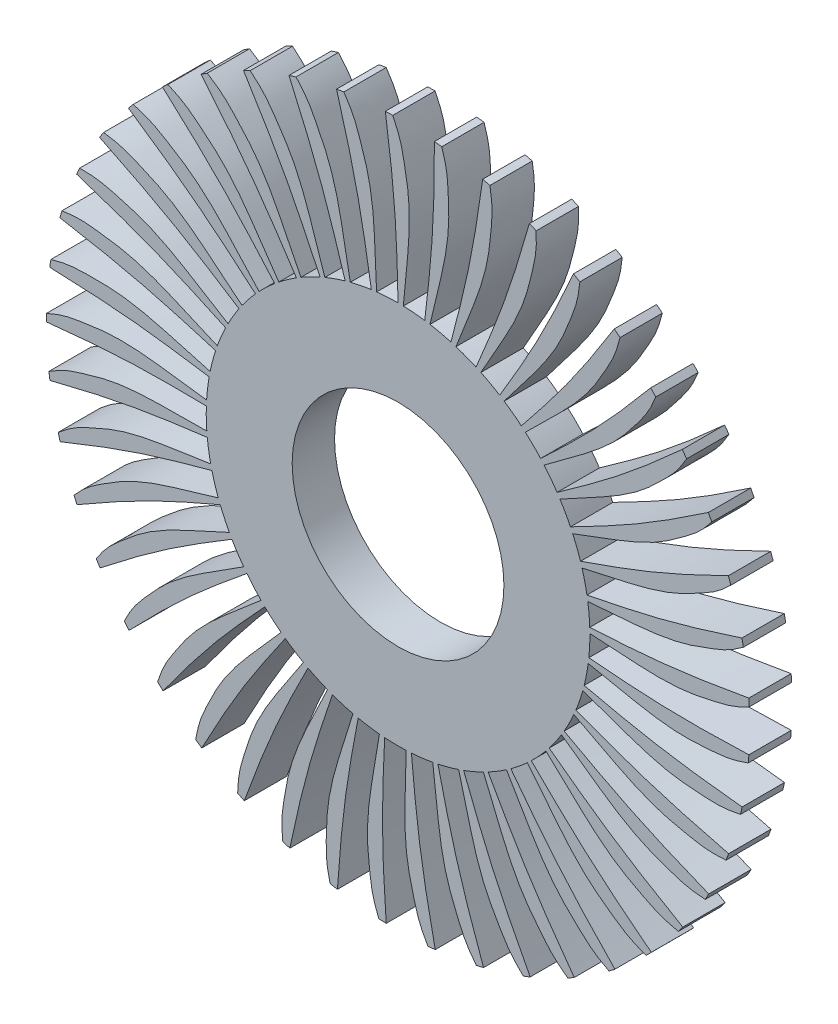
from build123d import *

# Parameters (mm, degrees)
BOSS_EXTRUDE1_DEPTH = 40
SKETCH2_R           = 100
CUT_EXTRUDE1_DEPTH  = 472.364222761


with BuildPart() as part:
    # Sketch1 → Boss-Extrude1 (new body)
    with BuildSketch(Plane.XY):
        with BuildLine():
            ThreePointArc((49.939154436, 174.158528494), (40.110835246, 176.681162236), (30.156704053, 178.649616271))
            add(Edge.make_bspline(
                [(30.156704053, 178.649616271), (39.310370514, 218.953952007), (49.29964751, 249.304595735), (47.011651755, 302.781305637), (46.663179355, 313.349789228), (41.265784538, 329.547796542)],
                knots=[0, 0, 0, 0, 0.60181753, 0.70181753, 1, 1, 1, 1], degree=3))
            ThreePointArc((41.265784538, 329.547796542), (37.789474803, 329.964499262), (34.308965449, 330.344532373))
            add(Edge.make_bspline(
                [(25.214967549, 179.413816649), (31.339924784, 231.63978581), (34.519677665, 260.968132794), (34.308965449, 330.344532373)],
                knots=[0, 0, 0, 0, 1, 1, 1, 1], degree=3))
            ThreePointArc((25.214967549, 179.413816649), (15.131214125, 180.544062634), (5, 181.108012504))
            add(Edge.make_bspline(
                [(5, 181.108012504), (8.455304222, 222.294053362), (14.123373057, 253.739565367), (4.415124374, 306.37741614), (2.59919465, 316.794549991), (-5, 332.083747237)],
                knots=[0, 0, 0, 0, 0.60181753, 0.70181753, 1, 1, 1, 1], degree=3))
            ThreePointArc((-5, 332.083747237), (-8.500472337, 332.012585829), (-12, 331.904527205))
            add(Edge.make_bspline(
                [(0, 181.177018943), (-1.203100506, 233.747157854), (-2.136009757, 263.23261945), (-12, 331.904527205)],
                knots=[0, 0, 0, 0, 1, 1, 1, 1], degree=3))
            ThreePointArc((0, 181.177018943), (-10.142918867, 180.892878218), (-20.254023365, 180.041347281))
            add(Edge.make_bspline(
                [(-20.254023365, 180.041347281), (-22.564334949, 221.307453824), (-21.327796787, 253.235782983), (-38.267338382, 304.010238737), (-41.515380424, 314.073265186), (-51.168465225, 328.156065532)],
                knots=[0, 0, 0, 0, 0.60181753, 0.70181753, 1, 1, 1, 1], degree=3))
            ThreePointArc((-51.168465225, 328.156065532), (-54.624967452, 327.598425072), (-58.075399099, 327.00437795))
            add(Edge.make_bspline(
                [(-25.214967549, 179.413816649), (-33.722708814, 231.304907354), (-38.75012218, 260.373582591), (-58.075399099, 327.00437795)],
                knots=[0, 0, 0, 0, 1, 1, 1, 1], degree=3))
            ThreePointArc((-25.214967549, 179.413816649), (-35.219631481, 177.72081969), (-45.113825204, 175.470382027))
            add(Edge.make_bspline(
                [(-45.113825204, 175.470382027), (-53.144785007, 216.01335643), (-56.363845327, 247.803054136), (-80.204970924, 295.725847844), (-84.82190584, 305.238901528), (-96.340994478, 317.841199284)],
                knots=[0, 0, 0, 0, 0.60181753, 0.70181753, 1, 1, 1, 1], degree=3))
            ThreePointArc((-96.340994478, 317.841199284), (-99.686249711, 316.807933609), (-103.020426614, 315.739460441))
            add(Edge.make_bspline(
                [(-49.939154436, 174.158528494), (-65.585942954, 224.360569937), (-74.610007552, 252.446670117), (-103.020426614, 315.739460441)],
                knots=[0, 0, 0, 0, 1, 1, 1, 1], degree=3))
            ThreePointArc((-49.939154436, 174.158528494), (-59.61083403, 171.089627562), (-69.095537752, 167.484085381))
            add(Edge.make_bspline(
                [(-69.095537752, 167.484085381), (-82.690832275, 206.514804765), (-90.30283573, 237.547120711), (-120.581504939, 281.685489705), (-126.477469342, 290.463409856), (-139.638355859, 301.33991563)],
                knots=[0, 0, 0, 0, 0.60181753, 0.70181753, 1, 1, 1, 1], degree=3))
            ThreePointArc((-139.638355859, 301.33991563), (-142.807252511, 299.851136082), (-145.960278709, 298.329033482))
            add(Edge.make_bspline(
                [(-73.691332487, 165.513442685), (-96.172621317, 213.049309233), (-109.017693995, 239.606170364), (-145.960278709, 298.329033482)],
                knots=[0, 0, 0, 0, 1, 1, 1, 1], degree=3))
            ThreePointArc((-73.691332487, 165.513442685), (-82.841779501, 161.128370445), (-91.732384252, 156.237901524))
            add(Edge.make_bspline(
                [(-91.732384252, 156.237901524), (-110.627396553, 192.996677333), (-122.484184154, 222.667602788), (-158.611057119, 262.162443922), (-165.67129277, 270.034378309), (-180.21781548, 278.973393288)],
                knots=[0, 0, 0, 0, 0.60181753, 0.70181753, 1, 1, 1, 1], degree=3))
            ThreePointArc((-180.21781548, 278.973393288), (-183.148674581, 277.058077266), (-186.059180006, 275.111971231))
            add(Edge.make_bspline(
                [(-96.009192574, 153.646825982), (-124.887409, 197.591286065), (-141.303475029, 222.102009052), (-186.059180006, 275.111971231)],
                knots=[0, 0, 0, 0, 1, 1, 1, 1], degree=3))
            ThreePointArc((-96.009192574, 153.646825982), (-104.460303965, 148.030932878), (-112.583764237, 141.950724631))
            add(Edge.make_bspline(
                [(-112.583764237, 141.950724631), (-136.410724394, 175.722089106), (-152.281517256, 203.454113257), (-193.55342549, 237.536704374), (-201.640512932, 244.349434747), (-217.289540318, 251.176971173)],
                knots=[0, 0, 0, 0, 0.60181753, 0.70181753, 1, 1, 1, 1], degree=3))
            ThreePointArc((-217.289540318, 251.176971173), (-219.925316029, 248.872398125), (-222.536651003, 246.540167395))
            add(Edge.make_bspline(
                [(-116.458342937, 138.789648582), (-151.171405325, 178.28737327), (-170.838944653, 200.274884771), (-222.536651003, 246.540167395)],
                knots=[0, 0, 0, 0, 1, 1, 1, 1], degree=3))
            ThreePointArc((-116.458342937, 138.789648582), (-124.045627434, 132.052241585), (-131.243829313, 124.900638351))
            add(Edge.make_bspline(
                [(-131.243829313, 124.900638351), (-159.538972649, 155.027270296), (-179.114863844, 180.280620837), (-224.728496598, 208.287583068), (-233.685029873, 213.908507381), (-250.131971416, 218.491675023)],
                knots=[0, 0, 0, 0, 0.60181753, 0.70181753, 1, 1, 1, 1], degree=3))
            ThreePointArc((-250.131971416, 218.491675023), (-252.421361362, 215.842700843), (-254.682699221, 213.169739636))
            add(Edge.make_bspline(
                [(-134.640764123, 121.231088544), (-174.513022201, 155.513299554), (-197.049228545, 174.549637668), (-254.682699221, 213.169739636)],
                knots=[0, 0, 0, 0, 1, 1, 1, 1], degree=3))
            ThreePointArc((-134.640764123, 121.231088544), (-141.216543865, 113.503303616), (-147.349382539, 105.419503217))
            add(Edge.make_bspline(
                [(-147.349382539, 105.419503217), (-179.561976275, 131.315022011), (-202.461943346, 153.598171198), (-251.529483145, 174.984380882), (-261.18113352, 179.304094236), (-278.105868212, 181.55368695)],
                knots=[0, 0, 0, 0, 0.60181753, 0.70181753, 1, 1, 1, 1], degree=3))
            ThreePointArc((-278.105868212, 181.55368695), (-280.004312021, 178.611870907), (-281.871638395, 175.650205372))
            add(Edge.make_bspline(
                [(-150.202555987, 101.312903265), (-194.457941604, 129.712336355), (-219.424173344, 145.426980414), (-281.871638395, 175.650205372)],
                knots=[0, 0, 0, 0, 1, 1, 1, 1], degree=3))
            ThreePointArc((-150.202555987, 101.312903265), (-155.638840901, 92.745152951), (-160.586947642, 83.886497366))
            add(Edge.make_bspline(
                [(-160.586947642, 83.886497366), (-196.090010281, 105.046876191), (-221.868331419, 123.926107873), (-273.434734412, 138.275306764), (-283.593643492, 141.209730852), (-300.666750623, 141.081962875)],
                knots=[0, 0, 0, 0, 0.60181753, 0.70181753, 1, 1, 1, 1], degree=3))
            ThreePointArc((-300.666750623, 141.081962875), (-302.137297246, 137.904564071), (-303.574266753, 134.71183966))
            add(Edge.make_bspline(
                [(-162.840825952, 79.422777566), (-210.617958367, 101.386670075), (-237.5282762, 113.473752408), (-303.574266753, 134.71183966)],
                knots=[0, 0, 0, 0, 1, 1, 1, 1], degree=3))
            ThreePointArc((-162.840825952, 79.422777566), (-167.031804936, 70.18182338), (-170.698870473, 60.720736263))
            add(Edge.make_bspline(
                [(-170.698870473, 60.720736263), (-208.801375286, 76.734112415), (-236.956304791, 91.841963822), (-290.017889602, 98.874861086), (-300.486325777, 100.366880681), (-317.375496737, 97.86423887)],
                knots=[0, 0, 0, 0, 0.60181753, 0.70181753, 1, 1, 1, 1], degree=3))
            ThreePointArc((-317.375496737, 97.86423887), (-318.389523657, 94.51310176), (-319.368167318, 91.151461221))
            add(Edge.make_bspline(
                [(-172.309584469, 55.986777844), (-222.678536145, 71.087627587), (-251.009161345, 79.311886885), (-319.368167318, 91.151461221)],
                knots=[0, 0, 0, 0, 1, 1, 1, 1], degree=3))
            ThreePointArc((-172.309584469, 55.986777844), (-175.173684883, 46.252484448), (-177.488333958, 36.373115097))
            add(Edge.make_bspline(
                [(-177.488333958, 36.373115097), (-217.44865903, 46.927806424), (-247.432193225, 57.970220413), (-300.956176461, 57.549928705), (-311.530383528, 57.570503343), (-327.906889817, 52.741698775)],
                knots=[0, 0, 0, 0, 0.60181753, 0.70181753, 1, 1, 1, 1], degree=3))
            ThreePointArc((-327.906889817, 52.741698775), (-328.444660153, 49.28204943), (-328.945929783, 45.816923272))
            add(Edge.make_bspline(
                [(-178.424532923, 31.461059175), (-230.40492951, 39.40494529), (-259.604438682, 43.6063057), (-328.945929783, 45.816923272)],
                knots=[0, 0, 0, 0, 1, 1, 1, 1], degree=3))
            ThreePointArc((-178.424532923, 31.461059175), (-179.906008311, 21.422893517), (-180.823188913, 11.31753262))
            add(Edge.make_bspline(
                [(-180.823188913, 11.31753262), (-221.863551969, 16.208104061), (-253.092095468, 22.970152605), (-306.036693677, 15.104852423), (-316.510856725, 13.653581643), (-332.055948274, 6.592601507)],
                knots=[0, 0, 0, 0, 0.60181753, 0.70181753, 1, 1, 1, 1], degree=3))
            ThreePointArc((-332.055948274, 6.592601507), (-332.106994939, 3.091778065), (-332.121133895, -0.409388971))
            add(Edge.make_bspline(
                [(-181.066650798, 6.322986775), (-233.646753003, 6.955290555), (-263.146810916, 7.051977377), (-332.121133895, -0.409388971)],
                knots=[0, 0, 0, 0, 1, 1, 1, 1], degree=3))
            ThreePointArc((-181.066650798, 6.322986775), (-181.136665928, -3.823669668), (-180.638526178, -13.958332756))
            add(Edge.make_bspline(
                [(-180.638526178, -13.958332756), (-221.960123235, -14.827070611), (-253.82584796, -12.477003096), (-305.160554763, -27.634222629), (-315.330806121, -30.529091493), (-329.741915407, -39.684813252)],
                knots=[0, 0, 0, 0, 0.60181753, 0.70181753, 1, 1, 1, 1], degree=3))
            ThreePointArc((-329.741915407, -39.684813252), (-329.305244835, -43.158671243), (-328.831977918, -46.627732925))
            add(Edge.make_bspline(
                [(-180.184512277, -18.93815537), (-232.340908219, -25.629741), (-261.567329801, -29.639609665), (-328.831977918, -46.627732925)],
                knots=[0, 0, 0, 0, 1, 1, 1, 1], degree=3))
            ThreePointArc((-180.184512277, -18.93815537), (-178.841704382, -28.995809473), (-176.937940005, -38.962515062))
            add(Edge.make_bspline(
                [(-176.937940005, -38.962515062), (-217.736493179, -45.573653219), (-249.619169045, -47.681308124), (-298.344812766, -69.835428971), (-308.01320006, -74.117550589), (-321.009831232, -85.189808261)],
                knots=[0, 0, 0, 0, 0.60181753, 0.70181753, 1, 1, 1, 1], degree=3))
            ThreePointArc((-321.009831232, -85.189808261), (-320.093942719, -88.569086107), (-319.142481531, -91.938521095))
            add(Edge.make_bspline(
                [(-175.79528718, -43.830687862), (-226.51281194, -57.715918799), (-254.896738139, -65.75429542), (-319.142481531, -91.938521095)],
                knots=[0, 0, 0, 0, 1, 1, 1, 1], degree=3))
            ThreePointArc((-175.79528718, -43.830687862), (-173.065792489, -53.603578828), (-169.793458093, -63.208336332))
            add(Edge.make_bspline(
                [(-169.793458093, -63.208336332), (-209.274869954, -75.433196507), (-240.553936941, -81.957550726), (-285.72212835, -110.677368125), (-294.700467419, -116.263395871), (-306.029655835, -129.036680554)],
                knots=[0, 0, 0, 0, 0.60181753, 0.70181753, 1, 1, 1, 1], degree=3))
            ThreePointArc((-306.029655835, -129.036680554), (-304.652376109, -132.255604456), (-303.241239761, -135.45983053))
            add(Edge.make_bspline(
                [(-167.984406783, -67.870105872), (-216.275901431, -88.678721889), (-243.264871411, -100.589148608), (-303.241239761, -135.45983053)],
                knots=[0, 0, 0, 0, 1, 1, 1, 1], degree=3))
            ThreePointArc((-167.984406783, -67.870105872), (-163.921351806, -77.168015494), (-159.344139657, -86.223879233))
            add(Edge.make_bspline(
                [(-159.344139657, -86.223879233), (-196.739949433, -103.824518428), (-226.806596081, -114.638582829), (-267.53818771, -149.365098202), (-275.651725397, -156.146306399), (-285.092961291, -170.372000637)],
                knots=[0, 0, 0, 0, 0.60181753, 0.70181753, 1, 1, 1, 1], degree=3))
            ThreePointArc((-285.092961291, -170.372000637), (-283.281097536, -173.367917903), (-281.43775219, -176.344568448))
            add(Edge.make_bspline(
                [(-156.903900987, -90.588509472), (-201.829426511, -117.915494529), (-226.89813067, -133.466148438), (-281.43775219, -176.344568448)],
                knots=[0, 0, 0, 0, 1, 1, 1, 1], degree=3))
            ThreePointArc((-156.903900987, -90.588509472), (-151.586368467, -99.230464517), (-145.793368794, -107.561172403))
            add(Edge.make_bspline(
                [(-145.793368794, -107.561172403), (-180.375709584, -130.195014197), (-208.644722817, -145.088305316), (-244.146920566, -185.145606542), (-251.237736089, -192.990006688), (-258.607256544, -208.391223524)],
                knots=[0, 0, 0, 0, 0.60181753, 0.70181753, 1, 1, 1, 1], degree=3))
            ThreePointArc((-258.607256544, -208.391223524), (-256.396074626, -211.105822031), (-254.156398904, -213.796959929))
            add(Edge.make_bspline(
                [(-142.769439234, -111.543710778), (-183.454571381, -144.857176194), (-206.115075908, -163.745381503), (-254.156398904, -213.796959929)],
                knots=[0, 0, 0, 0, 1, 1, 1, 1], degree=3))
            ThreePointArc((-142.769439234, -111.543710778), (-136.300928893, -119.36150542), (-129.404895845, -126.804909702))
            add(Edge.make_bspline(
                [(-129.404895845, -126.804909702), (-160.500661722, -154.031412109), (-186.421817354, -172.714048976), (-216.003611326, -217.322466252), (-221.933690027, -226.077376019), (-227.08805571, -242.354348285)],
                knots=[0, 0, 0, 0, 0.60181753, 0.70181753, 1, 1, 1, 1], degree=3))
            ThreePointArc((-227.08805571, -242.354348285), (-224.52059377, -244.734791462), (-221.928180412, -247.088036776))
            add(Edge.make_bspline(
                [(-125.856132744, -130.327840633), (-161.508981696, -168.979377698), (-181.320225647, -190.837496975), (-221.928180412, -247.088036776)],
                knots=[0, 0, 0, 0, 1, 1, 1, 1], degree=3))
            ThreePointArc((-125.856132744, -130.327840633), (-118.362546778, -137.169310392), (-110.497703794, -143.580533672))
            add(Edge.make_bspline(
                [(-110.497703794, -143.580533672), (-137.501651047, -174.869763793), (-160.570423267, -196.978110131), (-183.656037493, -245.269391356), (-188.309957134, -254.764406385), (-191.14884418, -271.600321332)],
                knots=[0, 0, 0, 0, 0.60181753, 0.70181753, 1, 1, 1, 1], degree=3))
            ThreePointArc((-191.14884418, -271.600321332), (-188.275074945, -273.60027656), (-185.380382328, -275.569826046))
            add(Edge.make_bspline(
                [(-106.493179789, -146.575287315), (-136.419803396, -189.812587825), (-152.996183441, -214.215177643), (-185.380382328, -275.569826046)],
                knots=[0, 0, 0, 0, 1, 1, 1, 1], degree=3))
            ThreePointArc((-106.493179789, -146.575287315), (-98.120372325, -152.307270765), (-89.439799628, -157.561525874))
            add(Edge.make_bspline(
                [(-89.439799628, -157.561525874), (-111.826327139, -192.304474436), (-131.593708537, -217.408216433), (-147.733807795, -268.442426747), (-151.020985125, -278.492737371), (-151.489137827, -295.559903064)],
                knots=[0, 0, 0, 0, 0.60181753, 0.70181753, 1, 1, 1, 1], degree=3))
            ThreePointArc((-151.489137827, -295.559903064), (-148.364995946, -297.140443489), (-145.224365968, -298.687962108))
            add(Edge.make_bspline(
                [(-85.057458224, -159.969812757), (-108.675368798, -206.95131184), (-121.694244556, -233.423403544), (-145.224365968, -298.687962108)],
                knots=[0, 0, 0, 0, 1, 1, 1, 1], degree=3))
            ThreePointArc((-85.057458224, -159.969812757), (-75.968396435, -164.48074336), (-66.641051498, -168.475762199))
            add(Edge.make_bspline(
                [(-66.641051498, -168.475762199), (-83.974430975, -205.996197227), (-100.055671957, -233.606719099), (-108.936107574, -286.390535651), (-110.792561425, -296.800524005), (-108.880867722, -313.766747478)],
                knots=[0, 0, 0, 0, 0.60181753, 0.70181753, 1, 1, 1, 1], degree=3))
            ThreePointArc((-108.880867722, -313.766747478), (-105.567161063, -314.897109679), (-102.241722516, -315.99247674))
            add(Edge.make_bspline(
                [(-61.966189986, -170.250707757), (-78.815691763, -220.061963973), (-88.023665625, -248.088308411), (-102.241722516, -315.99247674)],
                knots=[0, 0, 0, 0, 1, 1, 1, 1], degree=3))
            ThreePointArc((-61.966189986, -170.250707757), (-52.337782122, -173.452785379), (-42.545211104, -176.11080945))
            add(Edge.make_bspline(
                [(-42.545211104, -176.11080945), (-54.488068031, -215.678438356), (-66.570165533, -245.258332702), (-68.018089931, -298.764378542), (-68.407686541, -309.331426044), (-64.153355377, -325.866479057)],
                knots=[0, 0, 0, 0, 0.60181753, 0.70181753, 1, 1, 1, 1], degree=3))
            ThreePointArc((-64.153355377, -325.866479057), (-60.714581471, -326.524661819), (-57.269060232, -327.146557248))
            add(Edge.make_bspline(
                [(-37.668820346, -177.217866387), (-47.42195694, -228.889360294), (-52.639806169, -257.92445655), (-57.269060232, -327.146557248)],
                knots=[0, 0, 0, 0, 1, 1, 1, 1], degree=3))
            ThreePointArc((-37.668820346, -177.217866387), (-27.688472413, -179.04876623), (-17.62127657, -180.318060119))
            add(Edge.make_bspline(
                [(-17.62127657, -180.318060119), (-23.941156823, -221.162744013), (-31.78894656, -252.136271837), (-25.776177537, -305.323112645), (-24.691333851, -315.841543736), (-18.177170944, -331.623590288)],
                knots=[0, 0, 0, 0, 0.60181753, 0.70181753, 1, 1, 1, 1], degree=3))
            ThreePointArc((-18.177170944, -331.623590288), (-14.680261612, -331.796782832), (-11.181720834, -331.933102143))
            add(Edge.make_bspline(
                [(-12.638269965, -180.735680831), (-15.105207666, -233.261685574), (-16.231372762, -262.740398528), (-11.181720834, -331.933102143)],
                knots=[0, 0, 0, 0, 1, 1, 1, 1], degree=3))
            ThreePointArc((-12.638269965, -180.735680831), (-2.500238083, -181.159766512), (7.645636068, -181.015624857))
            add(Edge.make_bspline(
                [(7.645636068, -181.015624857), (7.071741771, -222.342368427), (3.611008099, -254.10666524), (16.967438832, -305.93907966), (19.505607567, -316.204165042), (28.152811446, -330.926025551)],
                knots=[0, 0, 0, 0, 0.60181753, 0.70181753, 1, 1, 1, 1], degree=3))
            ThreePointArc((28.152811446, -330.926025551), (31.63979284, -330.610856882), (35.123258041, -330.258946773))
            add(Edge.make_bspline(
                [(12.638269965, -180.735680831), (17.505547294, -233.093837477), (20.492985852, -262.442397511), (35.123258041, -330.258946773)],
                knots=[0, 0, 0, 0, 1, 1, 1, 1], degree=3))
            ThreePointArc((12.638269965, -180.735680831), (22.736660537, -179.744698005), (32.763735097, -178.189926358))
            add(Edge.make_bspline(
                [(32.763735097, -178.189926358), (37.946996955, -219.194351551), (38.940678593, -251.131161447), (59.380803305, -300.60029049), (63.32289452, -310.412231953), (73.934831385, -323.787362149)],
                knots=[0, 0, 0, 0, 0.60181753, 0.70181753, 1, 1, 1, 1], degree=3))
            ThreePointArc((73.934831385, -323.787362149), (77.344014714, -322.989966666), (80.74460265, -322.156676668))
            add(Edge.make_bspline(
                [(37.668820346, -177.217866387), (49.775576687, -228.389082973), (56.818471808, -257.03625375), (80.74460265, -322.156676668)],
                knots=[0, 0, 0, 0, 1, 1, 1, 1], degree=3))
            ThreePointArc((37.668820346, -177.217866387), (47.531015922, -174.831103407), (57.24412529, -171.895963632))
            add(Edge.make_bspline(
                [(57.24412529, -171.895963632), (68.083657008, -211.779965951), (73.512413072, -243.267675254), (100.638387986, -289.410658593), (105.90767336, -298.578477858), (118.27779393, -310.346546045)],
                knots=[0, 0, 0, 0, 0.60181753, 0.70181753, 1, 1, 1, 1], degree=3))
            ThreePointArc((118.27779393, -310.346546045), (121.54282332, -309.082444145), (124.794345414, -307.7839933))
            add(Edge.make_bspline(
                [(61.966189986, -170.250707757), (81.076781099, -219.238994758), (92.038050839, -246.627191684), (124.794345414, -307.7839933)],
                knots=[0, 0, 0, 0, 1, 1, 1, 1], degree=3))
            ThreePointArc((61.966189986, -170.250707757), (71.400234148, -166.514620249), (80.610323699, -162.256241502))
            add(Edge.make_bspline(
                [(80.610323699, -162.256241502), (96.89514612, -200.24352421), (106.65331205, -230.669260475), (139.93716092, -272.587977426), (146.431079807, -280.933233319), (160.318613755, -290.865187437)],
                knots=[0, 0, 0, 0, 0.60181753, 0.70181753, 1, 1, 1, 1], degree=3))
            ThreePointArc((160.318613755, -290.865187437), (163.375939122, -289.158983424), (166.415108197, -287.420644601))
            add(Edge.make_bspline(
                [(85.057458224, -159.969812757), (110.799918191, -205.82166889), (125.466213903, -231.417811867), (166.415108197, -287.420644601)],
                knots=[0, 0, 0, 0, 1, 1, 1, 1], degree=3))
            ThreePointArc((85.057458224, -159.969812757), (93.879728032, -154.957119416), (102.40753385, -149.458386195))
            add(Edge.make_bspline(
                [(102.40753385, -149.458386195), (123.82068143, -184.809570044), (137.718325625, -213.581130923), (176.512216192, -250.459681344), (184.104371848, -257.819942951), (199.239014124, -265.722468809)],
                knots=[0, 0, 0, 0, 0.60181753, 0.70181753, 1, 1, 1, 1], degree=3))
            ThreePointArc((199.239014124, -265.722468809), (202.029128107, -263.607372005), (204.796790193, -261.462979991))
            add(Edge.make_bspline(
                [(106.493179789, -146.575287315), (138.366460907, -188.398258356), (156.452319829, -211.704147575), (204.796790193, -261.462979991)],
                knots=[0, 0, 0, 0, 1, 1, 1, 1], degree=3))
            ThreePointArc((106.493179789, -146.575287315), (114.531959798, -140.383554514), (122.211497841, -133.751493407))
            add(Edge.make_bspline(
                [(122.211497841, -133.751493407), (148.33618802, -165.778507814), (166.102808644, -192.335887602), (209.651661956, -223.456472457), (218.194281707, -229.688480658), (234.281453713, -235.407764581)],
                knots=[0, 0, 0, 0, 0.60181753, 0.70181753, 1, 1, 1, 1], degree=3))
            ThreePointArc((234.281453713, -235.407764581), (236.750049918, -232.924942938), (239.19233562, -230.416235885))
            add(Edge.make_bspline(
                [(125.856132744, -130.327840633), (163.239857852, -167.307890023), (184.393259311, -187.869902861), (239.19233562, -230.416235885)],
                knots=[0, 0, 0, 0, 1, 1, 1, 1], degree=3))
            ThreePointArc((125.856132744, -130.327840633), (132.954957243, -123.077583408), (139.636754041, -115.44127994))
            add(Edge.make_bspline(
                [(139.636754041, -115.44127994), (169.964499441, -143.520755501), (191.254289432, -167.347045008), (238.710476595, -192.103937512), (248.037288064, -197.086393357), (264.763871297, -200.511115988)],
                knots=[0, 0, 0, 0, 0.60181753, 0.70181753, 1, 1, 1, 1], degree=3))
            ThreePointArc((264.763871297, -200.511115988), (266.862901306, -197.708894806), (268.932274312, -194.884701843))
            add(Edge.make_bspline(
                [(142.769439234, -111.543710778), (184.935976647, -142.961063921), (208.745193745, -160.378984186), (268.932274312, -194.884701843)],
                knots=[0, 0, 0, 0, 1, 1, 1, 1], degree=3))
            ThreePointArc((142.769439234, -111.543710778), (148.790137681, -103.376047139), (154.344139657, -94.884133271))
            add(Edge.make_bspline(
                [(154.344139657, -94.884133271), (188.284645211, -118.469534934), (212.683223024, -139.100982538), (263.123063336, -157.012317938), (273.052530748, -160.648243591), (290.092961291, -161.7117466)],
                knots=[0, 0, 0, 0, 0.60181753, 0.70181753, 1, 1, 1, 1], degree=3))
            ThreePointArc((290.092961291, -161.7117466), (291.781569873, -158.644667926), (293.43775219, -155.559958757))
            add(Edge.make_bspline(
                [(156.903900987, -90.588509472), (203.032527017, -115.831663325), (229.034140427, -129.766471013), (293.43775219, -155.559958757)],
                knots=[0, 0, 0, 0, 1, 1, 1, 1], degree=3))
            ThreePointArc((156.903900987, -90.588509472), (161.729287334, -81.662413701), (166.047392159, -72.480174877))
            add(Edge.make_bspline(
                [(166.047392159, -72.480174877), (202.940044533, -91.112439626), (229.972519604, -108.147477667), (282.414258948, -118.864632195), (292.753116513, -121.083258499), (309.775721769, -119.764842008)],
                knots=[0, 0, 0, 0, 0.60181753, 0.70181753, 1, 1, 1, 1], degree=3))
            ThreePointArc((309.775721769, -119.764842008), (311.021042079, -116.492603041), (312.231798003, -113.207418021))
            add(Edge.make_bspline(
                [(167.984406783, -67.870105872), (217.177280195, -86.447731159), (244.865198088, -96.628201088), (312.231798003, -113.207418021)],
                knots=[0, 0, 0, 0, 1, 1, 1, 1], degree=3))
            ThreePointArc((167.984406783, -67.870105872), (171.520560374, -58.35931427), (174.518721049, -48.665472325))
            add(Edge.make_bspline(
                [(174.518721049, -48.665472325), (213.645446728, -61.981944321), (242.78566268, -75.08900516), (296.20858225, -78.403381592), (306.755595867, -79.16152551), (323.429050188, -75.486850998)],
                knots=[0, 0, 0, 0, 0.60181753, 0.70181753, 1, 1, 1, 1], degree=3))
            ThreePointArc((323.429050188, -75.486850998), (324.206843481, -72.073142147), (324.948607026, -68.651423664))
            add(Edge.make_bspline(
                [(175.79528718, -43.830687862), (227.09492465, -55.38119224), (255.930233199, -61.609173142), (324.948607026, -68.651423664)],
                knots=[0, 0, 0, 0, 1, 1, 1, 1], degree=3))
            ThreePointArc((175.79528718, -43.830687862), (177.973380808, -33.92031717), (179.593241545, -23.903551709))
            add(Edge.make_bspline(
                [(179.593241545, -23.903551709), (220.192483322, -31.645040972), (250.873258997, -40.56901058), (304.237542431, -36.416098349), (314.787426477, -35.699003471), (330.78720004, -29.739594298)],
                knots=[0, 0, 0, 0, 0.60181753, 0.70181753, 1, 1, 1, 1], degree=3))
            ThreePointArc((330.78720004, -29.739594298), (331.082327455, -26.250859522), (331.340661036, -22.759207436))
            add(Edge.make_bspline(
                [(180.184512277, -18.93815537), (232.592424713, -23.236721408), (262.013877436, -25.390992721), (331.340661036, -22.759207436)],
                knots=[0, 0, 0, 0, 1, 1, 1, 1], degree=3))
            ThreePointArc((180.184512277, -18.93815537), (180.962151826, -8.82109968), (181.17218388, 1.32362435))
            add(Edge.make_bspline(
                [(181.17218388, 1.32362435), (222.453723693, -0.692202897), (254.077892691, -5.259386355), (306.344864914, 6.279982825), (316.692277895, 8.458359062), (331.706953307, 16.586509777)],
                knots=[0, 0, 0, 0, 0.60181753, 0.70181753, 1, 1, 1, 1], degree=3))
            ThreePointArc((331.706953307, 16.586509777), (331.513670526, 20.082366223), (331.283545974, 23.575990877))
            add(Edge.make_bspline(
                [(181.066650798, 6.322986775), (233.562777799, 9.360025775), (262.997719585, 11.321394492), (331.283545974, 23.575990877)],
                knots=[0, 0, 0, 0, 1, 1, 1, 1], degree=3))
            ThreePointArc((181.066650798, 6.322986775), (180.428700401, 16.449810482), (179.224815735, 26.525037567))
            add(Edge.make_bspline(
                [(179.224815735, 26.525037567), (220.385155369, 30.274108121), (252.337189213, 30.152605843), (302.489533064, 48.853831277), (312.433074357, 52.451089258), (326.17040804, 62.589776306)],
                knots=[0, 0, 0, 0, 0.60181753, 0.70181753, 1, 1, 1, 1], degree=3))
            ThreePointArc((326.17040804, 62.589776306), (325.492477092, 66.024711554), (324.778373519, 69.452309345))
            add(Edge.make_bspline(
                [(178.424532923, 31.461059175), (229.987097089, 41.774590702), (258.862610278, 47.81342364), (324.778373519, 69.452309345)],
                knots=[0, 0, 0, 0, 1, 1, 1, 1], degree=3))
            ThreePointArc((178.424532923, 31.461059175), (176.383409556, 41.400543794), (173.789040417, 51.2101711))
            add(Edge.make_bspline(
                [(173.789040417, 51.2101711), (214.027040681, 60.65116806), (245.685029376, 64.977711866), (292.746586529, 90.476795474), (302.092716414, 95.422918664), (314.285326794, 107.374804033)],
                knots=[0, 0, 0, 0, 0.60181753, 0.70181753, 1, 1, 1, 1], degree=3))
            ThreePointArc((314.285326794, 107.374804033), (313.135942833, 110.681960975), (311.951759453, 113.976817612))
            add(Edge.make_bspline(
                [(172.309584469, 55.986777844), (221.93497914, 73.37606074), (249.689034714, 83.374818883), (311.951759453, 113.976817612)],
                knots=[0, 0, 0, 0, 1, 1, 1, 1], degree=3))
            ThreePointArc((172.309584469, 55.986777844), (168.905016278, 65.545462614), (164.97065911, 74.898556903))
            add(Edge.make_bspline(
                [(164.97065911, 74.898556903), (203.503133098, 89.847722002), (234.250889906, 98.538100638), (277.305660682, 130.338731763), (285.872467371, 136.5374495), (296.283039155, 150.069903338)],
                knots=[0, 0, 0, 0, 0.60181753, 0.70181753, 1, 1, 1, 1], degree=3))
            ThreePointArc((296.283039155, 150.069903338), (294.684573633, 153.184911926), (293.05335923, 156.282896771))
            add(Edge.make_bspline(
                [(162.840825952, 79.422777566), (209.56314927, 103.549349219), (235.655546107, 117.313418113), (293.05335923, 156.282896771)],
                knots=[0, 0, 0, 0, 1, 1, 1, 1], degree=3))
            ThreePointArc((162.840825952, 79.422777566), (158.139078985, 88.41461356), (152.941311574, 97.129127491))
            add(Edge.make_bspline(
                [(152.941311574, 97.129127491), (189.01826851, 117.295492236), (218.257323319, 130.180557367), (256.46729558, 167.663772896), (264.088035926, 174.99443419), (272.513939177, 189.844062676)],
                knots=[0, 0, 0, 0, 0.60181753, 0.70181753, 1, 1, 1, 1], degree=3))
            ThreePointArc((272.513939177, 189.844062676), (270.497504407, 192.706292811), (268.451008712, 195.547107113))
            add(Edge.make_bspline(
                [(150.202555987, 101.312903265), (193.112411074, 131.707167402), (217.035290348, 148.968645103), (268.451008712, 195.547107113)],
                knots=[0, 0, 0, 0, 1, 1, 1, 1], degree=3))
            ThreePointArc((150.202555987, 101.312903265), (144.295144399, 109.562874624), (137.935135377, 117.469190096))
            add(Edge.make_bspline(
                [(137.935135377, 117.469190096), (170.854378331, 142.460239136), (198.015626199, 159.289197625), (230.637086297, 201.725429404), (237.163431257, 210.045351272), (243.440665353, 225.923123278)],
                knots=[0, 0, 0, 0, 0.60181753, 0.70181753, 1, 1, 1, 1], degree=3))
            ThreePointArc((243.440665353, 225.923123278), (241.045508943, 228.476864906), (238.623564668, 231.005215447))
            add(Edge.make_bspline(
                [(134.640764123, 121.231088544), (172.902959458, 157.301455385), (194.190689537, 177.724366865), (238.623564668, 231.005215447)],
                knots=[0, 0, 0, 0, 1, 1, 1, 1], degree=3))
            ThreePointArc((134.640764123, 121.231088544), (127.642668961, 128.57861896), (120.244208668, 135.522848535))
            add(Edge.make_bspline(
                [(120.244208668, 135.522848535), (149.365002022, 164.852159526), (173.919780153, 185.297454841), (200.317788474, 231.860729888), (205.622710168, 241.007974515), (209.629095887, 257.604847269)],
                knots=[0, 0, 0, 0, 0.60181753, 0.70181753, 1, 1, 1, 1], degree=3))
            ThreePointArc((209.629095887, 257.604847269), (206.901836833, 259.800394715), (204.151584369, 261.967070027))
            add(Edge.make_bspline(
                [(116.458342937, 138.789648582), (149.328148411, 179.834049468), (167.566387843, 203.020885984), (204.151584369, 261.967070027)],
                knots=[0, 0, 0, 0, 1, 1, 1, 1], degree=3))
            ThreePointArc((116.458342937, 138.789648582), (108.505774164, 145.091726733), (100.212865214, 150.938708881))
            add(Edge.make_bspline(
                [(100.212865214, 150.938708881), (124.968405849, 184.035420148), (146.438783418, 207.69910787), (166.099532758, 257.483125003), (170.079776918, 267.279651676), (171.737334519, 284.27258593)],
                knots=[0, 0, 0, 0, 0.60181753, 0.70181753, 1, 1, 1, 1], degree=3))
            ThreePointArc((171.737334519, 284.27258593), (168.731055817, 286.067205359), (165.706025698, 287.830033572))
            add(Edge.make_bspline(
                [(96.009192574, 153.646825982), (122.846834813, 198.866378335), (137.680597013, 224.36583449), (165.706025698, 287.830033572)],
                knots=[0, 0, 0, 0, 1, 1, 1, 1], degree=3))
            ThreePointArc((96.009192574, 153.646825982), (87.256937895, 158.780789084), (78.230992328, 163.41671895))
            add(Edge.make_bspline(
                [(78.230992328, 163.41671895), (98.139441805, 199.636640654), (116.107522336, 226.058134019), (128.648338571, 278.093903972), (131.226434274, 288.349034443), (130.502901283, 305.407282061)],
                knots=[0, 0, 0, 0, 0.60181753, 0.70181753, 1, 1, 1, 1], degree=3))
            ThreePointArc((130.502901283, 305.407282061), (127.276116728, 306.766043247), (124.035187725, 308.090712916))
            add(Edge.make_bspline(
                [(73.691332487, 165.513442685), (93.974447311, 214.027999356), (105.115009972, 241.34375724), (124.035187725, 308.090712916)],
                knots=[0, 0, 0, 0, 1, 1, 1, 1], degree=3))
            ThreePointArc((73.691332487, 165.513442685), (64.309744584, 169.379363987), (54.726442164, 172.714008468))
            add(Edge.make_bspline(
                [(54.726442164, 172.714008468), (69.400305158, 211.352161033), (83.516360401, 240.017195726), (88.69315081, 293.291901428), (89.818918354, 303.806031248), (86.728377519, 320.597572842)],
                knots=[0, 0, 0, 0, 0.60181753, 0.70181753, 1, 1, 1, 1], degree=3))
            ThreePointArc((86.728377519, 320.597572842), (83.343892801, 321.494029045), (79.950145911, 322.35475698))
            add(Edge.make_bspline(
                [(49.939154436, 174.158528494), (63.272954088, 225.023808822), (70.503478828, 253.624198281), (79.950145911, 322.35475698)],
                knots=[0, 0, 0, 0, 1, 1, 1, 1], degree=3))
        make_face()
    extrude(amount=BOSS_EXTRUDE1_DEPTH)

    # Sketch2 → Cut-Extrude1 (cut, through all)
    with BuildSketch(Plane.XY.offset(40)):
        Circle(SKETCH2_R)
    extrude(amount=-CUT_EXTRUDE1_DEPTH, mode=Mode.SUBTRACT)


solid = part.part
